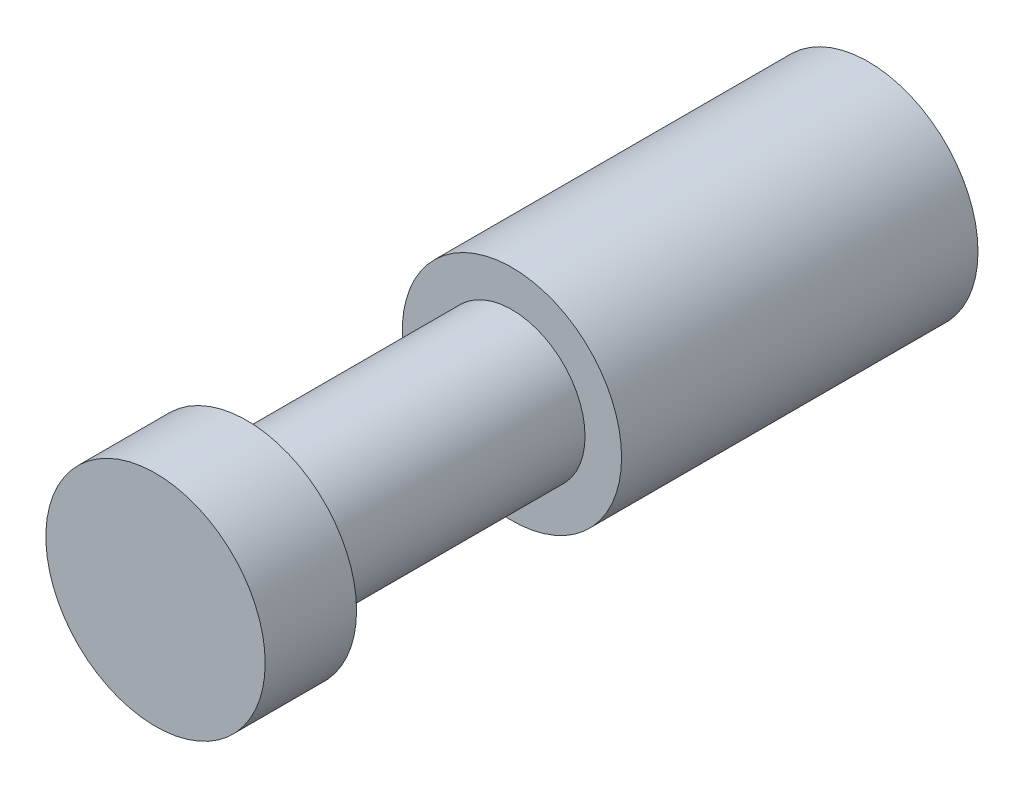
from build123d import *

# Parameters (mm, degrees)
SKETCH1_R           = 6
SKETCH1_R_2         = 4.4
BOSS_EXTRUDE1_DEPTH = 12
SKETCH2_R           = 6
BOSS_EXTRUDE2_DEPTH = 2
SKETCH3_R           = 4
BOSS_EXTRUDE3_DEPTH = 20
SKETCH4_R           = 6
BOSS_EXTRUDE4_DEPTH = 5
SKETCH5_R           = 6
BOSS_EXTRUDE5_DEPTH = 5.5


with BuildPart() as part:
    # Sketch1 → Boss-Extrude1 (new body)
    with BuildSketch(Plane.XY):
        Circle(SKETCH1_R)
        Circle(SKETCH1_R_2, mode=Mode.SUBTRACT)
    extrude(amount=BOSS_EXTRUDE1_DEPTH)

    # Sketch2 → Boss-Extrude2 (add)
    with BuildSketch(Plane.XY.offset(12)):
        Circle(SKETCH2_R)
    extrude(amount=BOSS_EXTRUDE2_DEPTH)

    # Sketch3 → Boss-Extrude3 (add)
    with BuildSketch(Plane.XY.offset(14)):
        Circle(SKETCH3_R)
    extrude(amount=BOSS_EXTRUDE3_DEPTH)

    # Sketch4 → Boss-Extrude4 (add)
    with BuildSketch(Plane.XY.offset(34)):
        Circle(SKETCH4_R)
    extrude(amount=BOSS_EXTRUDE4_DEPTH)

    # Sketch5 → Boss-Extrude5 (add)
    with BuildSketch(Plane.XY.offset(14)):
        Circle(SKETCH5_R)
    extrude(amount=BOSS_EXTRUDE5_DEPTH)


solid = part.part
